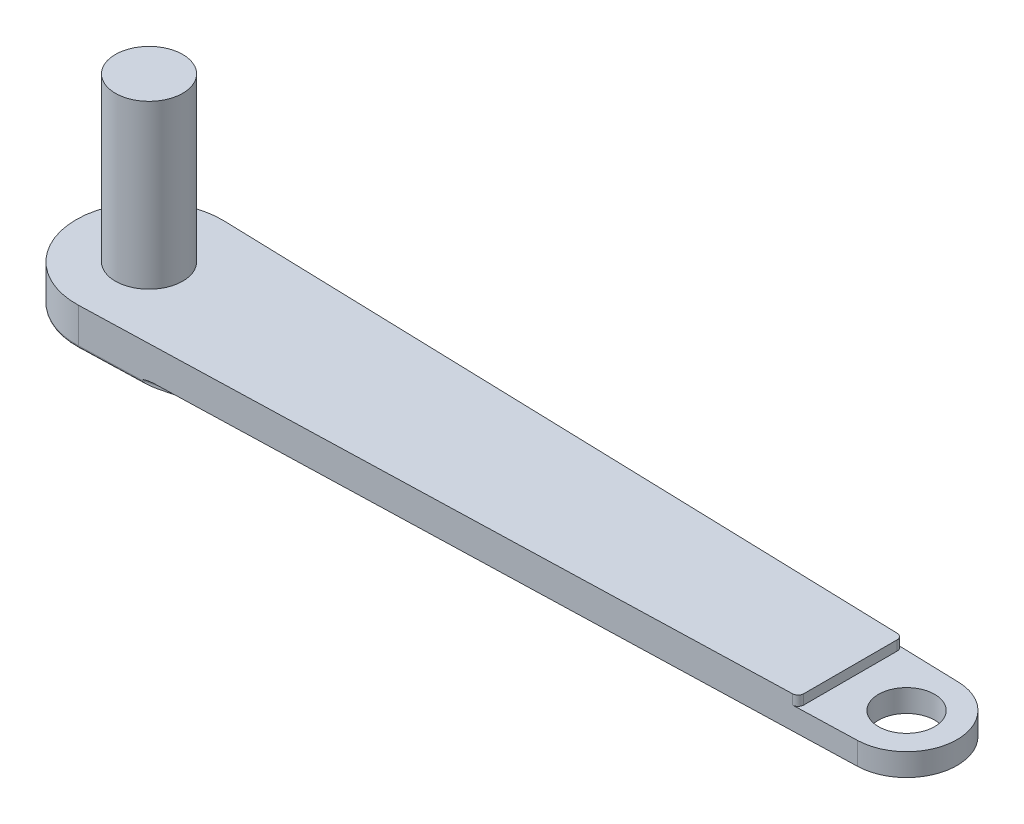
from build123d import *

# Parameters (mm, degrees)
SKETCH2_R           = 5
BOSS_EXTRUDE1_DEPTH = 6.75
CUT_EXTRUDE2_DEPTH  = 1.75
FILLET1_R           = 1
CUT_EXTRUDE4_DEPTH  = 1
FILLET2_R           = 0.5
FILLET3_R           = 0.5
SKETCH10_R          = 6
BOSS_EXTRUDE2_DEPTH = 29
SKETCH11_R          = 2.5
CUT_EXTRUDE6_DEPTH  = 20


with BuildPart() as part:
    # Sketch2 → Boss-Extrude1 (new body)
    with BuildSketch(Plane(origin=(0, 0, 0), x_dir=(1, 0, 0), z_dir=(0, 1, 0))):
        with BuildLine():
            Line((-23.525392368, 12.9942923), (111.356089114, 8.996048515))
            ThreePointArc((111.356089114, 8.996048515), (120.089422447, 0), (111.356089114, -8.996048515))
            Line((111.356089114, -8.996048515), (-23.525392368, -12.9942923))
            ThreePointArc((-23.525392368, -12.9942923), (-36.910577553, 0), (-23.525392368, 12.9942923))
        make_face()
        with Locations(Location((111.089422447, 0, 0), (0, 0, 270))):
            Circle(SKETCH2_R, mode=Mode.SUBTRACT)
    extrude(amount=BOSS_EXTRUDE1_DEPTH)

    # Sketch6 → Cut-Extrude2 (cut)
    with BuildSketch(Plane(origin=(0, 6.75, 0), x_dir=(1, 0, 0), z_dir=(0, 1, 0))):
        Polygon((101.089422447, 0), (101.089422447, 15.957712546), (123.696181887, 15.957712546), (123.696181887, -15.662199351), (101.089422447, -15.662199351), align=None)
    extrude(amount=-CUT_EXTRUDE2_DEPTH, mode=Mode.SUBTRACT)

    # Fillet1
    fillet1_edges = [part.edges().sort_by_distance(p)[0] for p in [
        (101.089422447, 5.875, -9.300379664),
        (101.089422447, 5.875, 9.300379664),
    ]]
    fillet(fillet1_edges, radius=FILLET1_R)

    # Sketch9 → Cut-Extrude4 (cut)
    with BuildSketch(Plane.XZ):
        with BuildLine():
            Line((-12.452129788, 12.666051515), (77.547870212, 9.998213524))
            ThreePointArc((77.547870212, 9.998213524), (146.089422447, 0), (77.547870212, -9.998213524))
            Line((77.547870212, -9.998213524), (-12.452129788, 12.666051515))
        make_face()
    extrude(amount=-CUT_EXTRUDE4_DEPTH, mode=Mode.SUBTRACT)

    # Fillet2
    fillet2_edges = [part.edges().sort_by_distance(p)[0] for p in [
        (32.547870212, 1, 1.333918996),
    ]]
    fillet(fillet2_edges, radius=FILLET2_R)

    # Fillet3
    fillet3_edges = [part.edges().sort_by_distance(p)[0] for p in [
        (-17.988761078, 0, 12.830171908),
        (-36.910577553, 0, 0),
        (27.011238922, 0, -11.496252912),
    ]]
    fillet(fillet3_edges, radius=FILLET3_R)

    # Sketch10 → Boss-Extrude2 (add)
    with BuildSketch(Plane(origin=(0, 6.75, 0), x_dir=(1, 0, 0), z_dir=(0, 1, 0))):
        with Locations(Location((-23.910577553, 0, 0), (0, 0, 90))):
            Circle(SKETCH10_R)
    extrude(amount=BOSS_EXTRUDE2_DEPTH)

    # Sketch11 → Cut-Extrude6 (cut)
    with BuildSketch(Plane.XZ):
        with Locations(Location((-23.910577553, 0, 0), (0, 0, 270))):
            Circle(SKETCH11_R)
    extrude(amount=-CUT_EXTRUDE6_DEPTH, mode=Mode.SUBTRACT)


solid = part.part
